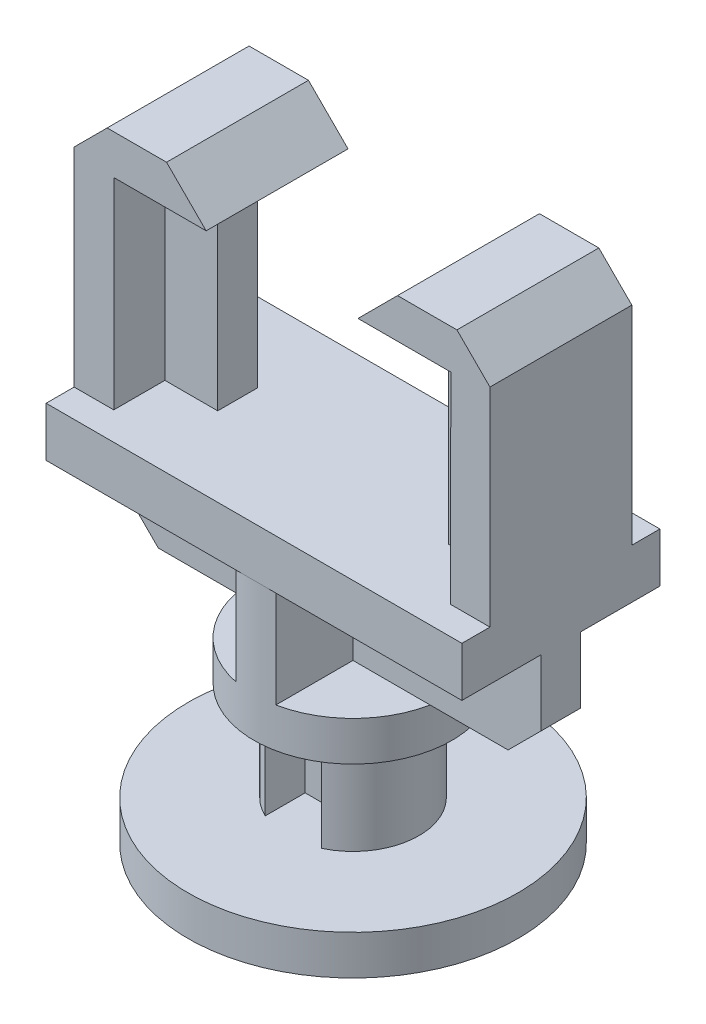
from build123d import *
from build123d.topology import SkipClean

# Parameters (mm, degrees)
SKETCH1_W           = 2.8
SKETCH1_H           = 1.2
SKETCH1_H_2         = 6.1
SKETCH1_H_3         = 4.5
SKETCH1_W_2         = 1.2
SKETCH1_W_3         = 4.6
BOSS_EXTRUDE1_DEPTH = 0.6
BOSS_EXTRUDE2_DEPTH = 1.55
BOSS_EXTRUDE3_DEPTH = 0.85
SKETCH6_R           = 3
BOSS_EXTRUDE4_DEPTH = 1.2
BOSS_EXTRUDE5_START = 3
BOSS_EXTRUDE5_DEPTH = 3
SKETCH8_R           = 2
BOSS_EXTRUDE6_DEPTH = 3
CUT_EXTRUDE1_START  = -3
CUT_EXTRUDE1_DEPTH  = 3
SKETCH10_R          = 5
BOSS_EXTRUDE7_DEPTH = 1.2
CHAMFER1_SIZE       = 1


with BuildPart() as part:
    # Sketch1 → Boss-Extrude1 (new, symmetric)
    with BuildSketch(Plane.XY):
        with Locations((-4.9, 5.3)):
            Rectangle(SKETCH1_W, SKETCH1_H)
        Polygon((-2.3, 4.7), (-3.5, 5.9), (-3.5, 4.7), align=None)
        with Locations((-4.9, 1.65)):
            Rectangle(SKETCH1_W, SKETCH1_H_2)
        with Locations((-4.9, -3.65)):
            Rectangle(SKETCH1_W, SKETCH1_H_3)
        with Locations((-2.9, -3.65)):
            Rectangle(SKETCH1_W_2, SKETCH1_H_3)
        with Locations((0, -3.65)):
            Rectangle(SKETCH1_W_3, SKETCH1_H_3)
        with Locations((2.9, -3.65)):
            Rectangle(SKETCH1_W_2, SKETCH1_H_3)
        with Locations((4.9, -3.65)):
            Rectangle(SKETCH1_W, SKETCH1_H_3)
        with Locations((4.9, 1.65)):
            Rectangle(SKETCH1_W, SKETCH1_H_2)
        Polygon((3.5, 5.9), (2.3, 4.7), (3.5, 4.7), align=None)
        with Locations((4.9, 5.3)):
            Rectangle(SKETCH1_W, SKETCH1_H)
    extrude(amount=BOSS_EXTRUDE1_DEPTH, both=True)

    # Sketch3 → Boss-Extrude2 (add)
    with BuildSketch(Plane.XY.offset(0.6)):
        Polygon((-6.3, 4.7), (-6.3, 5.9), (-5.1, 5.9), (-3.5, 5.9), (-2.3, 4.7), (-3.5, 4.7), (-5.1, 4.7), (-5.1, -1.4), (3.5, -1.4), (5.1, -1.4), (5.115943, 4.7), (3.5, 4.7), (2.3, 4.7), (3.5, 5.9), (6.3, 5.9), (6.3, -2.9), (-6.3, -2.9), align=None)
    boss_extrude2 = extrude(amount=BOSS_EXTRUDE2_DEPTH)

    # Mirror1: Boss-Extrude2 across plane
    add(boss_extrude2.mirror(Plane.XY))

    # Sketch5 → Boss-Extrude3 (add)
    with BuildSketch(Plane(origin=(0, 0, -2.15), x_dir=(-1, 0, 0), z_dir=(0, 0, -1))):
        Polygon((-5.1, -1.4), (-6.3, -1.4), (-6.3, -2.9), (6.3, -2.9), (6.3, -1.4), align=None)
    boss_extrude3 = extrude(amount=BOSS_EXTRUDE3_DEPTH)

    # Mirror2: Boss-Extrude3 across plane
    add(boss_extrude3.mirror(Plane.XY))

    # Sketch6 → Boss-Extrude4 (add)
    with BuildSketch(Plane.XZ.offset(5.9)):
        with Locations(Location((0, 0, 0), (0, 0, 11.536959))):
            Circle(SKETCH6_R)
    extrude(amount=BOSS_EXTRUDE4_DEPTH)

    # Sketch7 → Boss-Extrude5 (add)
    with SkipClean():  # the faces are left unmerged after this step: merging them gives an invalid solid
        with BuildSketch(Plane(origin=(0, -5.9, 0), x_dir=(1, 0, 0), z_dir=(0, 1, 0)).offset(BOSS_EXTRUDE5_START)):
            with BuildLine():
                Line((-0.6, 0.6), (-0.6, -2.939388))
                ThreePointArc((-0.6, -2.939388), (0, -3), (0.6, -2.939388))
                Line((0.6, -2.939388), (0.6, 0.6))
                Line((0.6, 0.6), (-0.6, 0.6))
            make_face()
            with BuildLine():
                Line((-0.6, 2.939388), (-0.6, 0.6))
                Line((-0.6, 0.6), (0.6, 0.6))
                Line((0.6, 0.6), (0.6, 2.939388))
                ThreePointArc((0.6, 2.939388), (0, 3), (-0.6, 2.939388))
            make_face()
        extrude(amount=-BOSS_EXTRUDE5_DEPTH)

    # Sketch8 → Boss-Extrude6 (add)
    with SkipClean():  # the faces are left unmerged after this step: merging them gives an invalid solid
        with BuildSketch(Plane.XZ.offset(7.1)):
            with Locations(Location((0, 0, 0), (0, 0, 270))):
                Circle(SKETCH8_R)
        extrude(amount=BOSS_EXTRUDE6_DEPTH)

    # Sketch9 → Cut-Extrude1 (cut)
    with SkipClean():  # the faces are left unmerged after this step: merging them gives an invalid solid
        with BuildSketch(Plane.XZ.offset(10.1).offset(CUT_EXTRUDE1_START)):
            with BuildLine():
                Line((-0.85, -0.6), (-0.85, -1.810387))
                ThreePointArc((-0.85, -1.810387), (0, -2), (0.85, -1.810387))
                Line((0.85, -1.810387), (0.85, -0.6))
                Line((0.85, -0.6), (-0.85, -0.6))
            make_face()
            with BuildLine():
                ThreePointArc((0.85, 1.810387), (0, 2), (-0.85, 1.810387))
                Line((-0.85, 1.810387), (-0.85, 0.6))
                Line((-0.85, 0.6), (0.85, 0.6))
                Line((0.85, 0.6), (0.85, 1.810387))
            make_face()
        extrude(amount=CUT_EXTRUDE1_DEPTH, mode=Mode.SUBTRACT)

    # Sketch10 → Boss-Extrude7 (add)
    with SkipClean():  # the faces are left unmerged after this step: merging them gives an invalid solid
        with BuildSketch(Plane.XZ.offset(10.1)):
            with Locations(Location((0, 0, 0), (0, 0, 270))):
                Circle(SKETCH10_R)
        extrude(amount=BOSS_EXTRUDE7_DEPTH)

    # Chamfer1
    chamfer1_edges = [part.edges().sort_by_distance(p)[0] for p in [
        (-6.3, 5.9, 0),
        (6.3, 5.9, 0),
        (6.3, -5.9, 0),
        (-6.3, -5.9, 0),
    ]]
    chamfer(chamfer1_edges, length=CHAMFER1_SIZE)


solid = part.part
